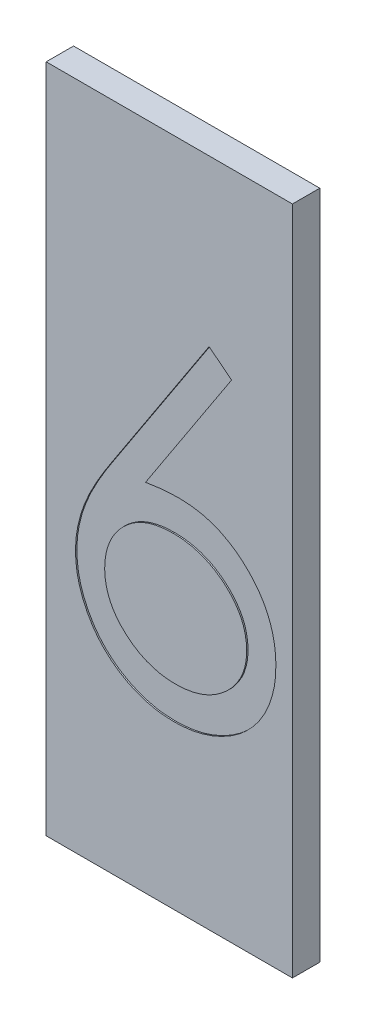
from build123d import *

# Parameters (mm, degrees)
SKETCH_1_W          = 18
SKETCH_1_H          = 49
EXTRUDE_1_DEPTH     = 2
CUT_EXTRUDE_1_DEPTH = 0.1


with BuildPart() as part:
    # ｽｹｯﾁ1 → ﾎﾞｽ - 押し出し1 (new body)
    with BuildSketch(Plane.XY):
        with Locations((9, 24.5)):
            Rectangle(SKETCH_1_W, SKETCH_1_H)
    extrude(amount=EXTRUDE_1_DEPTH)

    # ｽｹｯﾁ2 → ｶｯﾄ - 押し出し1 (cut)
    with BuildSketch(Plane.XY.offset(2)):
        with BuildLine():
            Line((11.90625, 36.923076923), (13.551945613, 35.630371094))
            Line((13.551945613, 35.630371094), (7.260141226, 26.009014423))
            add(Edge.make_bspline(
                [(7.260141226, 26.009014423), (7.679039003, 26.075783725), (8.496146481, 26.206024798), (9.323228755, 26.227510105), (9.726299579, 26.237980769)],
                knots=[0, 0, 0, 0, 1.025318673, 2, 2, 2, 2], degree=3))
            add(Edge.make_bspline(
                [(9.726299579, 26.237980769), (9.968319599, 26.231475795), (10.444728806, 26.218670947), (11.144182228, 26.120129034), (11.81629981, 25.964836755), (12.458295779, 25.738466585), (13.072474459, 25.449298781), (13.662360404, 25.102732539), (14.216865151, 24.680872463), (14.743129424, 24.209623389), (15.220924498, 23.687673905), (15.643943733, 23.133854097), (15.999272441, 22.54874096), (16.287566443, 21.932630854), (16.511437135, 21.286473499), (16.674638792, 20.611095621), (16.771110664, 19.906031503), (16.784210878, 19.426528203), (16.790865385, 19.182955228)],
                knots=[0, 0, 0, 0, 1.04369286, 2.054478336, 3.041073146, 4.015093852, 4.984733326, 5.965804835, 6.960378782, 7.985147595, 9.009457201, 10.008161701, 10.986880575, 11.956520048, 12.937015923, 13.931873656, 14.949455224, 16, 16, 16, 16], degree=3))
            add(Edge.make_bspline(
                [(16.790865385, 19.182955228), (16.781183189, 18.849718314), (16.762130919, 18.19398693), (16.57228545, 17.238923981), (16.277285009, 16.329065259), (15.855616468, 15.478937432), (15.331861327, 14.689705664), (14.693158419, 13.990397408), (13.962158972, 13.366713762), (13.135614863, 12.845174977), (12.246095768, 12.419250648), (11.311611643, 12.113326412), (10.341237665, 11.924979951), (9.682620599, 11.901367457), (9.349459135, 11.889423077)],
                knots=[0, 0, 0, 0, 1.031375318, 2.029502543, 3.004789286, 3.987476834, 4.960371455, 5.9300674, 6.912260825, 7.929083631, 8.949397511, 9.960523116, 10.96833055, 12, 12, 12, 12], degree=3))
            add(Edge.make_bspline(
                [(9.349459135, 11.889423077), (9.029033368, 11.899820334), (8.394326026, 11.920415479), (7.460652908, 12.103880164), (6.56351345, 12.40124456), (5.709193198, 12.810916705), (4.917797599, 13.328381944), (4.209779609, 13.95133245), (3.5886695, 14.666452204), (3.071770739, 15.473630281), (2.661796152, 16.341017313), (2.354343269, 17.245464752), (2.174754543, 18.183677128), (2.149659183, 18.819682735), (2.137019231, 19.140024038)],
                knots=[0, 0, 0, 0, 1.012016664, 2.004627821, 2.994792927, 3.992885782, 4.990978636, 5.973936114, 6.964471063, 7.975201453, 8.993600317, 9.990122807, 10.98767138, 12, 12, 12, 12], degree=3))
            add(Edge.make_bspline(
                [(2.137019231, 19.140024038), (2.145057276, 19.385255935), (2.161469429, 19.885972612), (2.276064639, 20.644326088), (2.460201903, 21.420280769), (2.666419829, 22.078554836), (2.884308355, 22.617816262), (3.065640812, 23.052588225), (3.291342463, 23.499998384), (3.532007789, 23.975388657), (3.809300058, 24.466507405), (4.110804744, 24.981562727), (4.444857726, 25.512363271), (4.679037762, 25.872572885), (4.798753005, 26.056715745)],
                knots=[0, 0, 0, 0, 1.173818275, 2.396712641, 3.66331629, 4.989737886, 5.693666774, 6.447286557, 7.243889047, 8.091586357, 8.998013824, 9.943181721, 10.948533338, 12, 12, 12, 12], degree=3))
            Line((4.798753005, 26.056715745), (11.90625, 36.923076923))
        make_face()
        with BuildLine():
            add(Edge.make_bspline(
                [(9.277907151, 23.795673077), (9.096508664, 23.790379601), (8.742184724, 23.780039905), (8.22234142, 23.719996673), (7.730353048, 23.606927674), (7.259701478, 23.462921022), (6.819185857, 23.264916277), (6.405604643, 23.024397787), (6.017358486, 22.741225129), (5.658513965, 22.419410002), (5.333169469, 22.06706642), (5.052990705, 21.689675564), (4.811311518, 21.296332503), (4.614812001, 20.883750718), (4.461799164, 20.452087926), (4.351116957, 20.003329462), (4.289519114, 19.534466057), (4.27927136, 19.216518137), (4.274038462, 19.054161659)],
                knots=[0, 0, 0, 0, 1.129588631, 2.206414736, 3.251139165, 4.268635594, 5.265702196, 6.250456724, 7.242448911, 8.251968645, 9.246821453, 10.222880186, 11.173611482, 12.116736599, 13.062300278, 14.020270554, 14.989073742, 16, 16, 16, 16], degree=3))
            add(Edge.make_bspline(
                [(4.274038462, 19.054161659), (4.278299957, 18.893257331), (4.286656114, 18.577747899), (4.362531719, 18.11279741), (4.478431118, 17.665361158), (4.650836312, 17.237745816), (4.856487104, 16.823433367), (5.127985828, 16.437430799), (5.428817888, 16.056294251), (5.7884134, 15.709302097), (6.174334852, 15.386427565), (6.586639462, 15.104213697), (7.01635276, 14.862780982), (7.469276185, 14.673566193), (7.938983762, 14.518279527), (8.42938896, 14.409004105), (8.940832852, 14.347224098), (9.287283894, 14.336962995), (9.463942308, 14.331730769)],
                knots=[0, 0, 0, 0, 0.989467248, 1.94019797, 2.891935182, 3.827694429, 4.772920941, 5.730924762, 6.725747692, 7.756678648, 8.79901574, 9.819492441, 10.826891316, 11.826466727, 12.835195252, 13.867842842, 14.912794438, 16, 16, 16, 16], degree=3))
            add(Edge.make_bspline(
                [(9.463942308, 14.331730769), (9.640600432, 14.336963405), (9.987050907, 14.347225313), (10.498498913, 14.408999488), (10.988888902, 14.518296468), (11.458651755, 14.67350478), (11.911371134, 14.863008803), (12.340708615, 15.102711685), (12.749114037, 15.388163129), (13.13528883, 15.708750328), (13.493387589, 16.058269196), (13.80143479, 16.434028557), (14.064618931, 16.826553095), (14.278483668, 17.236113739), (14.448989953, 17.665619717), (14.565477078, 18.112728143), (14.64119599, 18.577766034), (14.649573678, 18.893263456), (14.653846154, 19.054161659)],
                knots=[0, 0, 0, 0, 1.087397944, 2.132534446, 3.165364764, 4.174271784, 5.174024072, 6.181601208, 7.194203697, 8.236725232, 9.267838612, 10.269026844, 11.221737037, 12.171628256, 13.107553087, 14.05945871, 15.010357665, 16, 16, 16, 16], degree=3))
            add(Edge.make_bspline(
                [(14.653846154, 19.054161659), (14.650102196, 19.216729943), (14.642754025, 19.535798614), (14.559641946, 20.003119731), (14.444373295, 20.454368009), (14.270317319, 20.886707412), (14.044190112, 21.298431846), (13.768758361, 21.69162113), (13.450129624, 22.069289743), (13.082073149, 22.420100993), (12.681409236, 22.740869506), (12.255399628, 23.02403113), (11.80971145, 23.263006418), (11.344796592, 23.462399382), (10.855328051, 23.60629134), (10.349208064, 23.719592868), (9.819963396, 23.779886239), (9.460893971, 23.790343772), (9.277907151, 23.795673077)],
                knots=[0, 0, 0, 0, 0.978206639, 1.919901502, 2.851605144, 3.780102724, 4.718870031, 5.675451981, 6.667674623, 7.690630536, 8.733308323, 9.756129687, 10.767539656, 11.776269907, 12.797430371, 13.836405707, 14.897401972, 16, 16, 16, 16], degree=3))
        make_face(mode=Mode.SUBTRACT)
    extrude(amount=-CUT_EXTRUDE_1_DEPTH, mode=Mode.SUBTRACT)


solid = part.part
